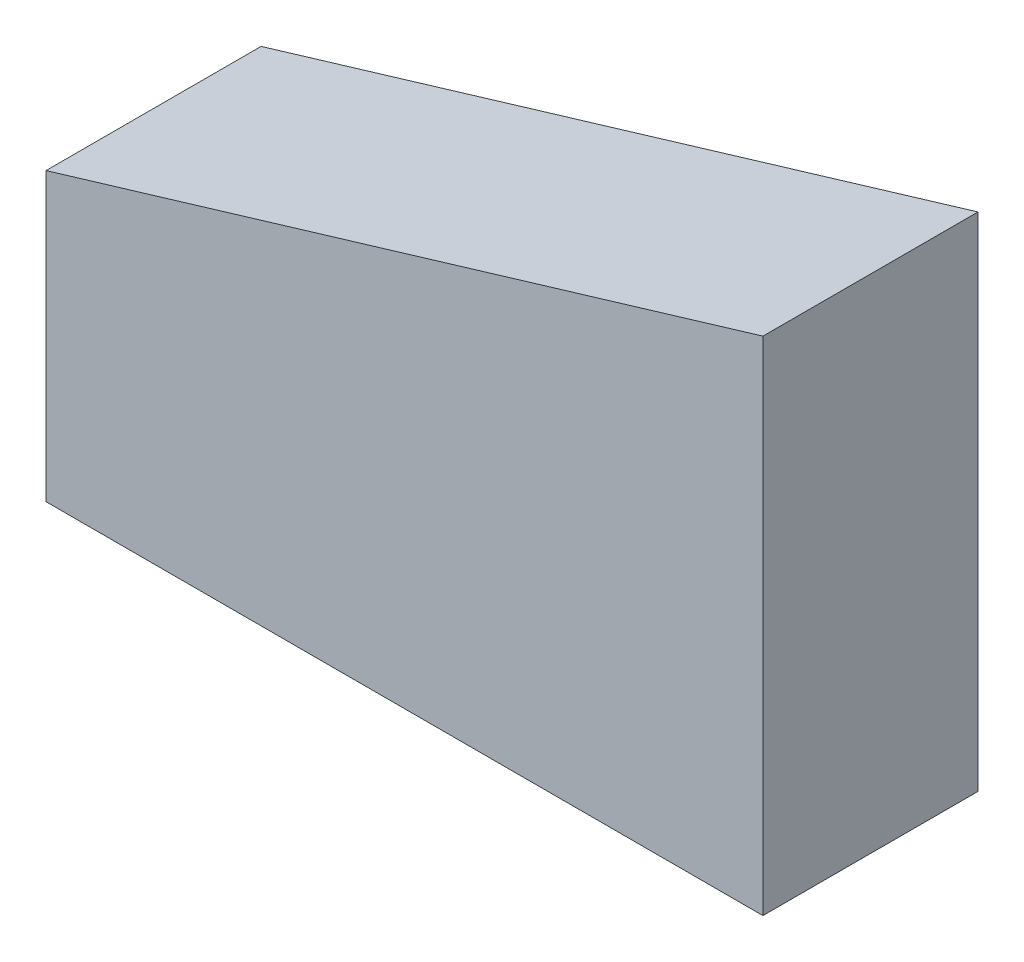
from build123d import *

# Parameters (mm, degrees)
BOSS_EXTRUDE1_DEPTH = 19.05


with BuildPart() as part:
    # Sketch1 → Boss-Extrude1 (new body)
    with BuildSketch(Plane.XY):
        Polygon((-26.816733068, 0.037948207), (36.683266932, 19.087948207), (36.683266932, -25.362051793), (-26.816733068, -25.362051793), align=None)
    extrude(amount=BOSS_EXTRUDE1_DEPTH)


solid = part.part
